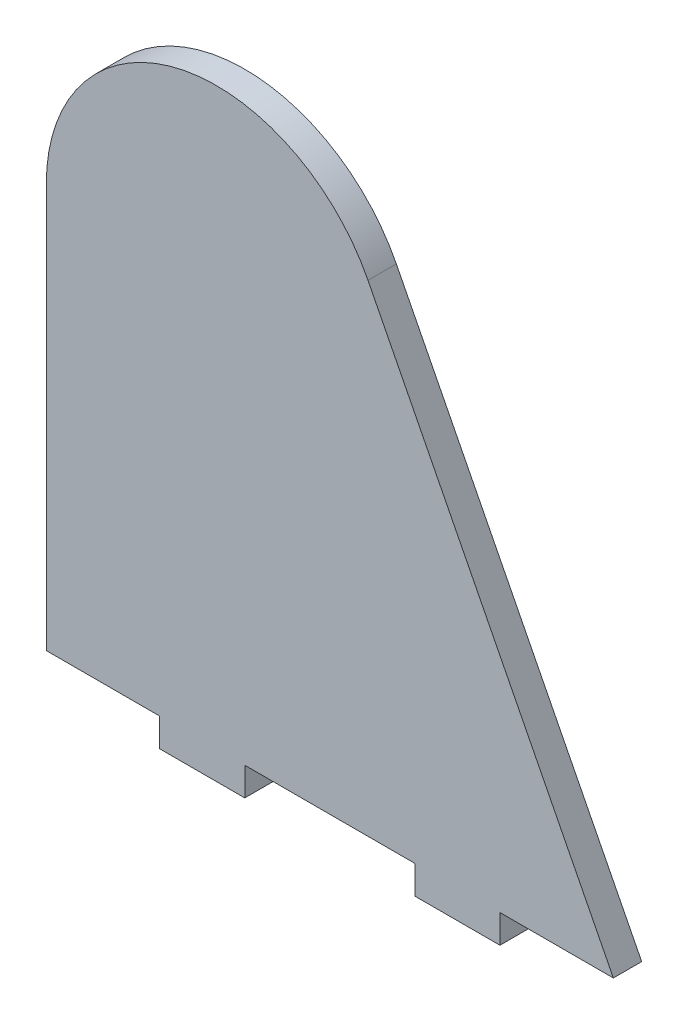
from build123d import *

# Parameters (mm, degrees)
BOSS_EXTRUDE1_DEPTH = 5


with BuildPart() as part:
    # Sketch1 → Boss-Extrude1 (new body)
    with BuildSketch(Plane.XY):
        with BuildLine():
            Line((0, 71.302057448), (0, 0))
            Line((0, 0), (20, 0))
            Line((20, 0), (20, -5))
            Line((20, -5), (35, -5))
            Line((35, -5), (35, 0))
            Line((35, 0), (65, 0))
            Line((65, 0), (65, -5))
            Line((65, -5), (80, -5))
            Line((80, -5), (80, 0))
            Line((80, 0), (100, 0))
            Line((100, 0), (56.730195726, 84.92177244))
            ThreePointArc((56.730195726, 84.92177244), (22.996639084, 100.47315506), (0, 71.302057448))
        make_face()
    extrude(amount=BOSS_EXTRUDE1_DEPTH)


solid = part.part
